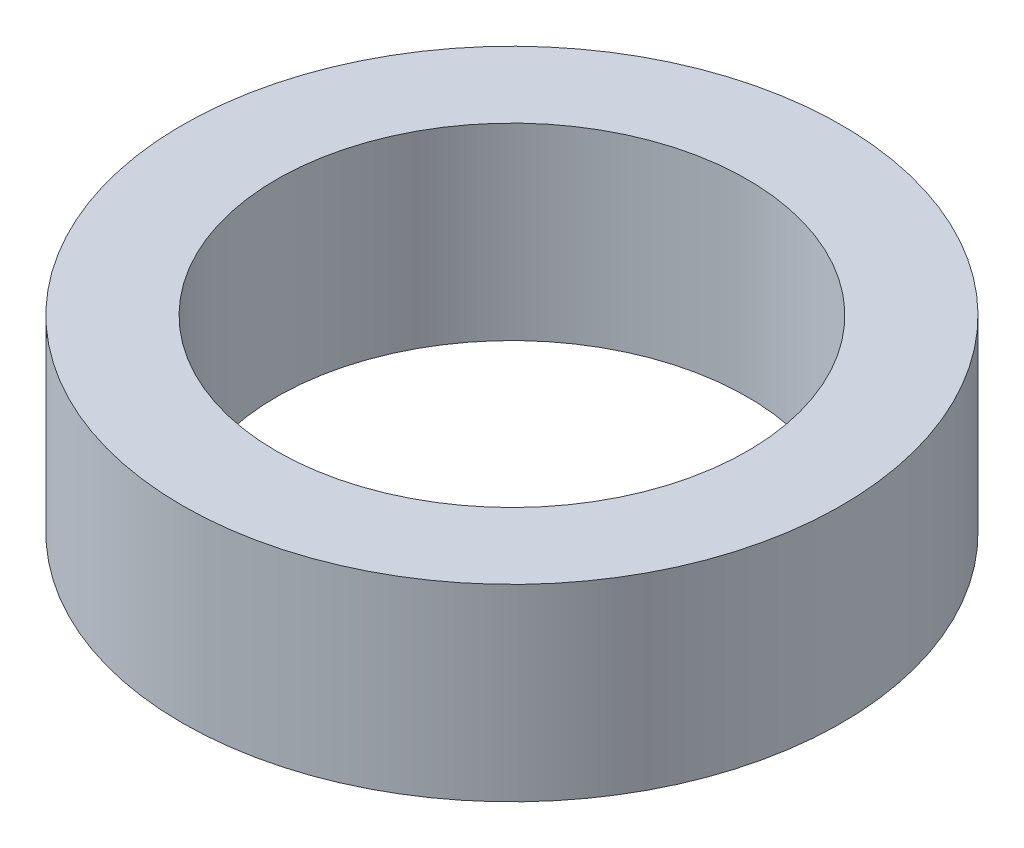
from build123d import *

# Parameters (mm, degrees)
SKETCH_1_R      = 14
SKETCH_1_R_2    = 10
EXTRUDE_1_DEPTH = 8


with BuildPart() as part:
    # 스케치1 → 보스-돌출1 (new body)
    with BuildSketch(Plane(origin=(0, 0, 0), x_dir=(1, 0, 0), z_dir=(0, 1, 0))):
        with Locations(Location((0, 0, 0), (0, 0, 270))):
            Circle(SKETCH_1_R)
        with Locations(Location((0, 0, 0), (0, 0, 270))):
            Circle(SKETCH_1_R_2, mode=Mode.SUBTRACT)
    extrude(amount=EXTRUDE_1_DEPTH)


solid = part.part
